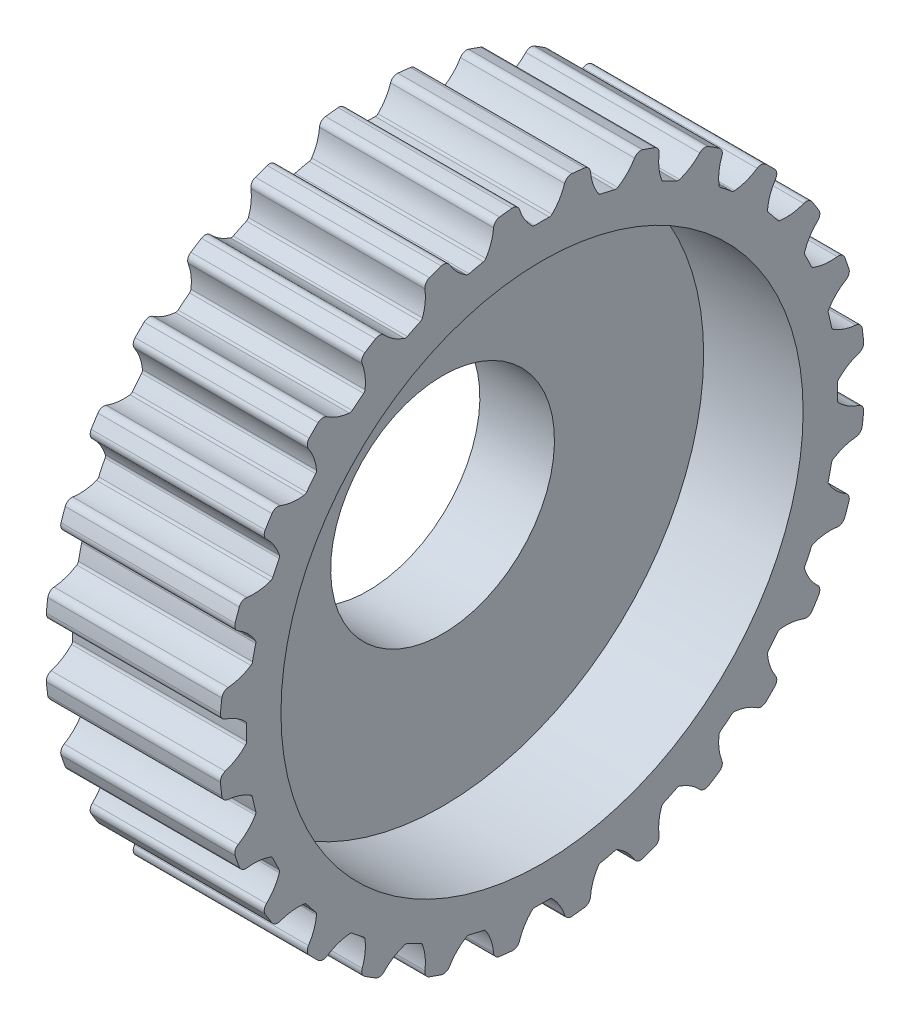
from build123d import *

# Parameters (mm, degrees)
HOLE_WIZARD_1_D          = 9
SKETCH_4_R               = 17.99
CUT_EXTRUDE_1_DEPTH      = 7
CUT_EXTRUDE_2_DEPTH      = 24.895606291
CUT_EXTRUDE_2_DEPTH_BACK = 24.895606291
SKETCH_5_W               = 12.588560779
SKETCH_5_H               = 39.970458518
SKETCH_5_W_2             = 25.674974244
SKETCH_5_H_2             = 50.140877678
SKETCH_6_R               = 10.5
CUT_EXTRUDE_3_DEPTH      = 4


with BuildPart() as part:
    # 草图1 → 旋转1 (revolve)
    with BuildSketch(Plane.XY, mode=Mode.PRIVATE) as revolve_1_sk:
        Polygon((0, 0), (0, 10), (1, 10), (1, 12.858347502), (0.495496297, 14.741180955), (1.461422123, 15), (2, 12.99), (9, 12.99), (9.538577877, 15), (10.504503703, 14.741180955), (10, 12.858347502), (10, 10), (11, 10), (11, 0), align=None)
    revolve(revolve_1_sk.sketch.rotate(Axis((11, 0, 0), (-1, 0, 0)), 270), axis=Axis((11, 0, 0), (-1, 0, 0)))

    # 孔1 (through all)
    with Locations(Plane(origin=(11, 0, 0), x_dir=(0, 0, -1), z_dir=(1, 0, 0))):
        with Locations((0, 0)):
            Hole(HOLE_WIZARD_1_D / 2)

    # 草图4 → 切除-拉伸1 (cut)
    with BuildSketch(Plane(origin=(2, 0, 0), x_dir=(0, 0, -1), z_dir=(1, 0, 0))):
        Circle(SKETCH_4_R)
        with BuildLine():
            ThreePointArc((-12.934335103, 1.201280746), (-12.888789145, 1.020492007), (-12.739828866, 0.908376719))
            ThreePointArc((-12.739828866, 0.908376719), (-12.297942775, 0.706183335), (-11.918804359, 0.402210404))
            ThreePointArc((-11.918804359, 0.402210404), (-11.886657302, 0.352337477), (-11.876364008, 0.293901271))
            ThreePointArc((-11.876364008, 0.293901271), (-11.88, 0), (-11.876364008, -0.293901271))
            ThreePointArc((-11.876364008, -0.293901271), (-11.886657302, -0.352337477), (-11.918804359, -0.402210404))
            ThreePointArc((-11.918804359, -0.402210404), (-12.297942775, -0.706183335), (-12.739828866, -0.908376719))
            ThreePointArc((-12.739828866, -0.908376719), (-12.888789145, -1.020492007), (-12.934335103, -1.201280746))
            ThreePointArc((-12.934335103, -1.201280746), (-12.908321607, -1.454418545), (-12.877354431, -1.706998197))
            ThreePointArc((-12.877354431, -1.706998197), (-12.792721126, -1.873119256), (-12.622547594, -1.9492768))
            ThreePointArc((-12.622547594, -1.9492768), (-12.146748249, -2.048071867), (-11.709475284, -2.260057328))
            ThreePointArc((-11.709475284, -2.260057328), (-11.667036451, -2.301526443), (-11.643997952, -2.356207058))
            ThreePointArc((-11.643997952, -2.356207058), (-11.582143597, -2.643548695), (-11.513199581, -2.929272164))
            ThreePointArc((-11.513199581, -2.929272164), (-11.510231522, -2.988533726), (-11.530474814, -3.044309627))
            ThreePointArc((-11.530474814, -3.044309627), (-11.832467099, -3.425027557), (-12.218281922, -3.720480436))
            ThreePointArc((-12.218281922, -3.720480436), (-12.338559457, -3.86293154), (-12.342734204, -4.049322457))
            ThreePointArc((-12.342734204, -4.049322457), (-12.261044461, -4.290325015), (-12.174649437, -4.529681124))
            ThreePointArc((-12.174649437, -4.529681124), (-12.055172652, -4.672804499), (-11.872319078, -4.70918544))
            ThreePointArc((-11.872319078, -4.70918544), (-11.386465046, -4.699628195), (-10.912984224, -4.808996348))
            ThreePointArc((-10.912984224, -4.808996348), (-10.862381675, -4.839982218), (-10.827753217, -4.888165327))
            ThreePointArc((-10.827753217, -4.888165327), (-10.703510151, -5.154538821), (-10.572715252, -5.417757118))
            ThreePointArc((-10.572715252, -5.417757118), (-10.556634671, -5.474872414), (-10.563959116, -5.533754454))
            ThreePointArc((-10.563959116, -5.533754454), (-10.773662114, -5.972126595), (-11.084059304, -6.346023728))
            ThreePointArc((-11.084059304, -6.346023728), (-11.169622877, -6.511667555), (-11.132217073, -6.694314232))
            ThreePointArc((-11.132217073, -6.694314232), (-10.998947348, -6.911096674), (-10.861456683, -7.125226924))
            ThreePointArc((-10.861456683, -7.125226924), (-10.713127484, -7.238175812), (-10.526762909, -7.232955859))
            ThreePointArc((-10.526762909, -7.232955859), (-10.055216939, -7.11552554), (-9.569270566, -7.116792211))
            ThreePointArc((-9.569270566, -7.116792211), (-9.513041724, -7.135741074), (-9.468559724, -7.175010575))
            ThreePointArc((-9.468559724, -7.175010575), (-9.288158012, -7.407058846), (-9.102070833, -7.634573108))
            ThreePointArc((-9.102070833, -7.634573108), (-9.073684076, -7.686678138), (-9.067722396, -7.745713725))
            ThreePointArc((-9.067722396, -7.745713725), (-9.174620723, -8.219758268), (-9.394035669, -8.653350892))
            ThreePointArc((-9.394035669, -8.653350892), (-9.440594765, -8.833881369), (-9.363484094, -9.003625138))
            ThreePointArc((-9.363484094, -9.003625138), (-9.185317088, -9.185317088), (-9.003625138, -9.363484094))
            ThreePointArc((-9.003625138, -9.363484094), (-8.833881369, -9.440594765), (-8.653350892, -9.394035669))
            ThreePointArc((-8.653350892, -9.394035669), (-8.219758268, -9.174620723), (-7.745713725, -9.067722396))
            ThreePointArc((-7.745713725, -9.067722396), (-7.686678138, -9.073684076), (-7.634573108, -9.102070833))
            ThreePointArc((-7.634573108, -9.102070833), (-7.407058846, -9.288158012), (-7.175010575, -9.468559724))
            ThreePointArc((-7.175010575, -9.468559724), (-7.135741074, -9.513041724), (-7.116792211, -9.569270566))
            ThreePointArc((-7.116792211, -9.569270566), (-7.11552554, -10.055216939), (-7.232955859, -10.526762909))
            ThreePointArc((-7.232955859, -10.526762909), (-7.238175812, -10.713127484), (-7.125226924, -10.861456683))
            ThreePointArc((-7.125226924, -10.861456683), (-6.911096674, -10.998947348), (-6.694314232, -11.132217073))
            ThreePointArc((-6.694314232, -11.132217073), (-6.511667555, -11.169622877), (-6.346023728, -11.084059304))
            ThreePointArc((-6.346023728, -11.084059304), (-5.972126595, -10.773662114), (-5.533754454, -10.563959116))
            ThreePointArc((-5.533754454, -10.563959116), (-5.474872414, -10.556634671), (-5.417757118, -10.572715252))
            ThreePointArc((-5.417757118, -10.572715252), (-5.154538821, -10.703510151), (-4.888165327, -10.827753217))
            ThreePointArc((-4.888165327, -10.827753217), (-4.839982218, -10.862381675), (-4.808996348, -10.912984224))
            ThreePointArc((-4.808996348, -10.912984224), (-4.699628195, -11.386465046), (-4.70918544, -11.872319078))
            ThreePointArc((-4.70918544, -11.872319078), (-4.672804499, -12.055172652), (-4.529681124, -12.174649437))
            ThreePointArc((-4.529681124, -12.174649437), (-4.290325015, -12.261044461), (-4.049322457, -12.342734204))
            ThreePointArc((-4.049322457, -12.342734204), (-3.86293154, -12.338559457), (-3.720480436, -12.218281922))
            ThreePointArc((-3.720480436, -12.218281922), (-3.425027557, -11.832467099), (-3.044309627, -11.530474814))
            ThreePointArc((-3.044309627, -11.530474814), (-2.988533726, -11.510231522), (-2.929272164, -11.513199581))
            ThreePointArc((-2.929272164, -11.513199581), (-2.643548695, -11.582143597), (-2.356207058, -11.643997952))
            ThreePointArc((-2.356207058, -11.643997952), (-2.301526443, -11.667036451), (-2.260057328, -11.709475284))
            ThreePointArc((-2.260057328, -11.709475284), (-2.048071867, -12.146748249), (-1.9492768, -12.622547594))
            ThreePointArc((-1.9492768, -12.622547594), (-1.873119256, -12.792721126), (-1.706998197, -12.877354431))
            ThreePointArc((-1.706998197, -12.877354431), (-1.454418545, -12.908321607), (-1.201280746, -12.934335103))
            ThreePointArc((-1.201280746, -12.934335103), (-1.020492007, -12.888789145), (-0.908376719, -12.739828866))
            ThreePointArc((-0.908376719, -12.739828866), (-0.706183335, -12.297942775), (-0.402210404, -11.918804359))
            ThreePointArc((-0.402210404, -11.918804359), (-0.352337477, -11.886657302), (-0.293901271, -11.876364008))
            ThreePointArc((-0.293901271, -11.876364008), (0, -11.88), (0.293901271, -11.876364008))
            ThreePointArc((0.293901271, -11.876364008), (0.352337477, -11.886657302), (0.402210404, -11.918804359))
            ThreePointArc((0.402210404, -11.918804359), (0.706183335, -12.297942775), (0.908376719, -12.739828866))
            ThreePointArc((0.908376719, -12.739828866), (1.020492007, -12.888789145), (1.201280746, -12.934335103))
            ThreePointArc((1.201280746, -12.934335103), (1.454418545, -12.908321607), (1.706998197, -12.877354431))
            ThreePointArc((1.706998197, -12.877354431), (1.873119256, -12.792721126), (1.9492768, -12.622547594))
            ThreePointArc((1.9492768, -12.622547594), (2.048071867, -12.146748249), (2.260057328, -11.709475284))
            ThreePointArc((2.260057328, -11.709475284), (2.301526443, -11.667036451), (2.356207058, -11.643997952))
            ThreePointArc((2.356207058, -11.643997952), (2.643548695, -11.582143597), (2.929272164, -11.513199581))
            ThreePointArc((2.929272164, -11.513199581), (2.988533726, -11.510231522), (3.044309627, -11.530474814))
            ThreePointArc((3.044309627, -11.530474814), (3.425027557, -11.832467099), (3.720480436, -12.218281922))
            ThreePointArc((3.720480436, -12.218281922), (3.86293154, -12.338559457), (4.049322457, -12.342734204))
            ThreePointArc((4.049322457, -12.342734204), (4.290325015, -12.261044461), (4.529681124, -12.174649437))
            ThreePointArc((4.529681124, -12.174649437), (4.672804499, -12.055172652), (4.70918544, -11.872319078))
            ThreePointArc((4.70918544, -11.872319078), (4.699628195, -11.386465046), (4.808996348, -10.912984224))
            ThreePointArc((4.808996348, -10.912984224), (4.839982218, -10.862381675), (4.888165327, -10.827753217))
            ThreePointArc((4.888165327, -10.827753217), (5.154538821, -10.703510151), (5.417757118, -10.572715252))
            ThreePointArc((5.417757118, -10.572715252), (5.474872414, -10.556634671), (5.533754454, -10.563959116))
            ThreePointArc((5.533754454, -10.563959116), (5.972126595, -10.773662114), (6.346023728, -11.084059304))
            ThreePointArc((6.346023728, -11.084059304), (6.511667555, -11.169622877), (6.694314232, -11.132217073))
            ThreePointArc((6.694314232, -11.132217073), (6.911096674, -10.998947348), (7.125226924, -10.861456683))
            ThreePointArc((7.125226924, -10.861456683), (7.238175812, -10.713127484), (7.232955859, -10.526762909))
            ThreePointArc((7.232955859, -10.526762909), (7.11552554, -10.055216939), (7.116792211, -9.569270566))
            ThreePointArc((7.116792211, -9.569270566), (7.135741074, -9.513041724), (7.175010575, -9.468559724))
            ThreePointArc((7.175010575, -9.468559724), (7.407058846, -9.288158012), (7.634573108, -9.102070833))
            ThreePointArc((7.634573108, -9.102070833), (7.686678138, -9.073684076), (7.745713725, -9.067722396))
            ThreePointArc((7.745713725, -9.067722396), (8.219758268, -9.174620723), (8.653350892, -9.394035669))
            ThreePointArc((8.653350892, -9.394035669), (8.833881369, -9.440594765), (9.003625138, -9.363484094))
            ThreePointArc((9.003625138, -9.363484094), (9.185317088, -9.185317088), (9.363484094, -9.003625138))
            ThreePointArc((9.363484094, -9.003625138), (9.440594765, -8.833881369), (9.394035669, -8.653350892))
            ThreePointArc((9.394035669, -8.653350892), (9.174620723, -8.219758268), (9.067722396, -7.745713725))
            ThreePointArc((9.067722396, -7.745713725), (9.073684076, -7.686678138), (9.102070833, -7.634573108))
            ThreePointArc((9.102070833, -7.634573108), (9.288158012, -7.407058846), (9.468559724, -7.175010575))
            ThreePointArc((9.468559724, -7.175010575), (9.513041724, -7.135741074), (9.569270566, -7.116792211))
            ThreePointArc((9.569270566, -7.116792211), (10.055216939, -7.11552554), (10.526762909, -7.232955859))
            ThreePointArc((10.526762909, -7.232955859), (10.713127484, -7.238175812), (10.861456683, -7.125226924))
            ThreePointArc((10.861456683, -7.125226924), (10.998947348, -6.911096674), (11.132217073, -6.694314232))
            ThreePointArc((11.132217073, -6.694314232), (11.169622877, -6.511667555), (11.084059304, -6.346023728))
            ThreePointArc((11.084059304, -6.346023728), (10.773662114, -5.972126595), (10.563959116, -5.533754454))
            ThreePointArc((10.563959116, -5.533754454), (10.556634671, -5.474872414), (10.572715252, -5.417757118))
            ThreePointArc((10.572715252, -5.417757118), (10.703510151, -5.154538821), (10.827753217, -4.888165327))
            ThreePointArc((10.827753217, -4.888165327), (10.862381675, -4.839982218), (10.912984224, -4.808996348))
            ThreePointArc((10.912984224, -4.808996348), (11.386465046, -4.699628195), (11.872319078, -4.70918544))
            ThreePointArc((11.872319078, -4.70918544), (12.055172652, -4.672804499), (12.174649437, -4.529681124))
            ThreePointArc((12.174649437, -4.529681124), (12.261044461, -4.290325015), (12.342734204, -4.049322457))
            ThreePointArc((12.342734204, -4.049322457), (12.338559457, -3.86293154), (12.218281922, -3.720480436))
            ThreePointArc((12.218281922, -3.720480436), (11.832467099, -3.425027557), (11.530474814, -3.044309627))
            ThreePointArc((11.530474814, -3.044309627), (11.510231522, -2.988533726), (11.513199581, -2.929272164))
            ThreePointArc((11.513199581, -2.929272164), (11.582143597, -2.643548695), (11.643997952, -2.356207058))
            ThreePointArc((11.643997952, -2.356207058), (11.667036451, -2.301526443), (11.709475284, -2.260057328))
            ThreePointArc((11.709475284, -2.260057328), (12.146748249, -2.048071867), (12.622547594, -1.9492768))
            ThreePointArc((12.622547594, -1.9492768), (12.792721126, -1.873119256), (12.877354431, -1.706998197))
            ThreePointArc((12.877354431, -1.706998197), (12.908321607, -1.454418545), (12.934335103, -1.201280746))
            ThreePointArc((12.934335103, -1.201280746), (12.888789145, -1.020492007), (12.739828866, -0.908376719))
            ThreePointArc((12.739828866, -0.908376719), (12.297942775, -0.706183335), (11.918804359, -0.402210404))
            ThreePointArc((11.918804359, -0.402210404), (11.886657302, -0.352337477), (11.876364008, -0.293901271))
            ThreePointArc((11.876364008, -0.293901271), (11.88, 0), (11.876364008, 0.293901271))
            ThreePointArc((11.876364008, 0.293901271), (11.886657302, 0.352337477), (11.918804359, 0.402210404))
            ThreePointArc((11.918804359, 0.402210404), (12.297942775, 0.706183335), (12.739828866, 0.908376719))
            ThreePointArc((12.739828866, 0.908376719), (12.888789145, 1.020492007), (12.934335103, 1.201280746))
            ThreePointArc((12.934335103, 1.201280746), (12.908321607, 1.454418545), (12.877354431, 1.706998197))
            ThreePointArc((12.877354431, 1.706998197), (12.792721126, 1.873119256), (12.622547594, 1.9492768))
            ThreePointArc((12.622547594, 1.9492768), (12.146748249, 2.048071867), (11.709475284, 2.260057328))
            ThreePointArc((11.709475284, 2.260057328), (11.667036451, 2.301526443), (11.643997952, 2.356207058))
            ThreePointArc((11.643997952, 2.356207058), (11.582143597, 2.643548695), (11.513199581, 2.929272164))
            ThreePointArc((11.513199581, 2.929272164), (11.510231522, 2.988533726), (11.530474814, 3.044309627))
            ThreePointArc((11.530474814, 3.044309627), (11.832467099, 3.425027557), (12.218281922, 3.720480436))
            ThreePointArc((12.218281922, 3.720480436), (12.338559457, 3.86293154), (12.342734204, 4.049322457))
            ThreePointArc((12.342734204, 4.049322457), (12.261044461, 4.290325015), (12.174649437, 4.529681124))
            ThreePointArc((12.174649437, 4.529681124), (12.055172652, 4.672804499), (11.872319078, 4.70918544))
            ThreePointArc((11.872319078, 4.70918544), (11.386465046, 4.699628195), (10.912984224, 4.808996348))
            ThreePointArc((10.912984224, 4.808996348), (10.862381675, 4.839982218), (10.827753217, 4.888165327))
            ThreePointArc((10.827753217, 4.888165327), (10.703510151, 5.154538821), (10.572715252, 5.417757118))
            ThreePointArc((10.572715252, 5.417757118), (10.556634671, 5.474872414), (10.563959116, 5.533754454))
            ThreePointArc((10.563959116, 5.533754454), (10.773662114, 5.972126595), (11.084059304, 6.346023728))
            ThreePointArc((11.084059304, 6.346023728), (11.169622877, 6.511667555), (11.132217073, 6.694314232))
            ThreePointArc((11.132217073, 6.694314232), (10.998947348, 6.911096674), (10.861456683, 7.125226924))
            ThreePointArc((10.861456683, 7.125226924), (10.713127484, 7.238175812), (10.526762909, 7.232955859))
            ThreePointArc((10.526762909, 7.232955859), (10.055216939, 7.11552554), (9.569270566, 7.116792211))
            ThreePointArc((9.569270566, 7.116792211), (9.513041724, 7.135741074), (9.468559724, 7.175010575))
            ThreePointArc((9.468559724, 7.175010575), (9.288158012, 7.407058846), (9.102070833, 7.634573108))
            ThreePointArc((9.102070833, 7.634573108), (9.073684076, 7.686678138), (9.067722396, 7.745713725))
            ThreePointArc((9.067722396, 7.745713725), (9.174620723, 8.219758268), (9.394035669, 8.653350892))
            ThreePointArc((9.394035669, 8.653350892), (9.440594765, 8.833881369), (9.363484094, 9.003625138))
            ThreePointArc((9.363484094, 9.003625138), (9.185317088, 9.185317088), (9.003625138, 9.363484094))
            ThreePointArc((9.003625138, 9.363484094), (8.833881369, 9.440594765), (8.653350892, 9.394035669))
            ThreePointArc((8.653350892, 9.394035669), (8.219758268, 9.174620723), (7.745713725, 9.067722396))
            ThreePointArc((7.745713725, 9.067722396), (7.686678138, 9.073684076), (7.634573108, 9.102070833))
            ThreePointArc((7.634573108, 9.102070833), (7.407058846, 9.288158012), (7.175010575, 9.468559724))
            ThreePointArc((7.175010575, 9.468559724), (7.135741074, 9.513041724), (7.116792211, 9.569270566))
            ThreePointArc((7.116792211, 9.569270566), (7.11552554, 10.055216939), (7.232955859, 10.526762909))
            ThreePointArc((7.232955859, 10.526762909), (7.238175812, 10.713127484), (7.125226924, 10.861456683))
            ThreePointArc((7.125226924, 10.861456683), (6.911096674, 10.998947348), (6.694314232, 11.132217073))
            ThreePointArc((6.694314232, 11.132217073), (6.511667555, 11.169622877), (6.346023728, 11.084059304))
            ThreePointArc((6.346023728, 11.084059304), (5.972126595, 10.773662114), (5.533754454, 10.563959116))
            ThreePointArc((5.533754454, 10.563959116), (5.474872414, 10.556634671), (5.417757118, 10.572715252))
            ThreePointArc((5.417757118, 10.572715252), (5.154538821, 10.703510151), (4.888165327, 10.827753217))
            ThreePointArc((4.888165327, 10.827753217), (4.839982218, 10.862381675), (4.808996348, 10.912984224))
            ThreePointArc((4.808996348, 10.912984224), (4.699628195, 11.386465046), (4.70918544, 11.872319078))
            ThreePointArc((4.70918544, 11.872319078), (4.672804499, 12.055172652), (4.529681124, 12.174649437))
            ThreePointArc((4.529681124, 12.174649437), (4.290325015, 12.261044461), (4.049322457, 12.342734204))
            ThreePointArc((4.049322457, 12.342734204), (3.86293154, 12.338559457), (3.720480436, 12.218281922))
            ThreePointArc((3.720480436, 12.218281922), (3.425027557, 11.832467099), (3.044309627, 11.530474814))
            ThreePointArc((3.044309627, 11.530474814), (2.988533726, 11.510231522), (2.929272164, 11.513199581))
            ThreePointArc((2.929272164, 11.513199581), (2.643548695, 11.582143597), (2.356207058, 11.643997952))
            ThreePointArc((2.356207058, 11.643997952), (2.301526443, 11.667036451), (2.260057328, 11.709475284))
            ThreePointArc((2.260057328, 11.709475284), (2.048071867, 12.146748249), (1.9492768, 12.622547594))
            ThreePointArc((1.9492768, 12.622547594), (1.873119256, 12.792721126), (1.706998197, 12.877354431))
            ThreePointArc((1.706998197, 12.877354431), (1.454418545, 12.908321607), (1.201280746, 12.934335103))
            ThreePointArc((1.201280746, 12.934335103), (1.020492007, 12.888789145), (0.908376719, 12.739828866))
            ThreePointArc((0.908376719, 12.739828866), (0.706183335, 12.297942775), (0.402210404, 11.918804359))
            ThreePointArc((0.402210404, 11.918804359), (0.352337477, 11.886657302), (0.293901271, 11.876364008))
            ThreePointArc((0.293901271, 11.876364008), (0, 11.88), (-0.293901271, 11.876364008))
            ThreePointArc((-0.293901271, 11.876364008), (-0.352337477, 11.886657302), (-0.402210404, 11.918804359))
            ThreePointArc((-0.402210404, 11.918804359), (-0.706183335, 12.297942775), (-0.908376719, 12.739828866))
            ThreePointArc((-0.908376719, 12.739828866), (-1.020492007, 12.888789145), (-1.201280746, 12.934335103))
            ThreePointArc((-1.201280746, 12.934335103), (-1.454418545, 12.908321607), (-1.706998197, 12.877354431))
            ThreePointArc((-1.706998197, 12.877354431), (-1.873119256, 12.792721126), (-1.9492768, 12.622547594))
            ThreePointArc((-1.9492768, 12.622547594), (-2.048071867, 12.146748249), (-2.260057328, 11.709475284))
            ThreePointArc((-2.260057328, 11.709475284), (-2.301526443, 11.667036451), (-2.356207058, 11.643997952))
            ThreePointArc((-2.356207058, 11.643997952), (-2.643548695, 11.582143597), (-2.929272164, 11.513199581))
            ThreePointArc((-2.929272164, 11.513199581), (-2.988533726, 11.510231522), (-3.044309627, 11.530474814))
            ThreePointArc((-3.044309627, 11.530474814), (-3.425027557, 11.832467099), (-3.720480436, 12.218281922))
            ThreePointArc((-3.720480436, 12.218281922), (-3.86293154, 12.338559457), (-4.049322457, 12.342734204))
            ThreePointArc((-4.049322457, 12.342734204), (-4.290325015, 12.261044461), (-4.529681124, 12.174649437))
            ThreePointArc((-4.529681124, 12.174649437), (-4.672804499, 12.055172652), (-4.70918544, 11.872319078))
            ThreePointArc((-4.70918544, 11.872319078), (-4.699628195, 11.386465046), (-4.808996348, 10.912984224))
            ThreePointArc((-4.808996348, 10.912984224), (-4.839982218, 10.862381675), (-4.888165327, 10.827753217))
            ThreePointArc((-4.888165327, 10.827753217), (-5.154538821, 10.703510151), (-5.417757118, 10.572715252))
            ThreePointArc((-5.417757118, 10.572715252), (-5.474872414, 10.556634671), (-5.533754454, 10.563959116))
            ThreePointArc((-5.533754454, 10.563959116), (-5.972126595, 10.773662114), (-6.346023728, 11.084059304))
            ThreePointArc((-6.346023728, 11.084059304), (-6.511667555, 11.169622877), (-6.694314232, 11.132217073))
            ThreePointArc((-6.694314232, 11.132217073), (-6.911096674, 10.998947348), (-7.125226924, 10.861456683))
            ThreePointArc((-7.125226924, 10.861456683), (-7.238175812, 10.713127484), (-7.232955859, 10.526762909))
            ThreePointArc((-7.232955859, 10.526762909), (-7.11552554, 10.055216939), (-7.116792211, 9.569270566))
            ThreePointArc((-7.116792211, 9.569270566), (-7.135741074, 9.513041724), (-7.175010575, 9.468559724))
            ThreePointArc((-7.175010575, 9.468559724), (-7.407058846, 9.288158012), (-7.634573108, 9.102070833))
            ThreePointArc((-7.634573108, 9.102070833), (-7.686678138, 9.073684076), (-7.745713725, 9.067722396))
            ThreePointArc((-7.745713725, 9.067722396), (-8.219758268, 9.174620723), (-8.653350892, 9.394035669))
            ThreePointArc((-8.653350892, 9.394035669), (-8.833881369, 9.440594765), (-9.003625138, 9.363484094))
            ThreePointArc((-9.003625138, 9.363484094), (-9.185317088, 9.185317088), (-9.363484094, 9.003625138))
            ThreePointArc((-9.363484094, 9.003625138), (-9.440594765, 8.833881369), (-9.394035669, 8.653350892))
            ThreePointArc((-9.394035669, 8.653350892), (-9.174620723, 8.219758268), (-9.067722396, 7.745713725))
            ThreePointArc((-9.067722396, 7.745713725), (-9.073684076, 7.686678138), (-9.102070833, 7.634573108))
            ThreePointArc((-9.102070833, 7.634573108), (-9.288158012, 7.407058846), (-9.468559724, 7.175010575))
            ThreePointArc((-9.468559724, 7.175010575), (-9.513041724, 7.135741074), (-9.569270566, 7.116792211))
            ThreePointArc((-9.569270566, 7.116792211), (-10.055216939, 7.11552554), (-10.526762909, 7.232955859))
            ThreePointArc((-10.526762909, 7.232955859), (-10.713127484, 7.238175812), (-10.861456683, 7.125226924))
            ThreePointArc((-10.861456683, 7.125226924), (-10.998947348, 6.911096674), (-11.132217073, 6.694314232))
            ThreePointArc((-11.132217073, 6.694314232), (-11.169622877, 6.511667555), (-11.084059304, 6.346023728))
            ThreePointArc((-11.084059304, 6.346023728), (-10.773662114, 5.972126595), (-10.563959116, 5.533754454))
            ThreePointArc((-10.563959116, 5.533754454), (-10.556634671, 5.474872414), (-10.572715252, 5.417757118))
            ThreePointArc((-10.572715252, 5.417757118), (-10.703510151, 5.154538821), (-10.827753217, 4.888165327))
            ThreePointArc((-10.827753217, 4.888165327), (-10.862381675, 4.839982218), (-10.912984224, 4.808996348))
            ThreePointArc((-10.912984224, 4.808996348), (-11.386465046, 4.699628195), (-11.872319078, 4.70918544))
            ThreePointArc((-11.872319078, 4.70918544), (-12.055172652, 4.672804499), (-12.174649437, 4.529681124))
            ThreePointArc((-12.174649437, 4.529681124), (-12.261044461, 4.290325015), (-12.342734204, 4.049322457))
            ThreePointArc((-12.342734204, 4.049322457), (-12.338559457, 3.86293154), (-12.218281922, 3.720480436))
            ThreePointArc((-12.218281922, 3.720480436), (-11.832467099, 3.425027557), (-11.530474814, 3.044309627))
            ThreePointArc((-11.530474814, 3.044309627), (-11.510231522, 2.988533726), (-11.513199581, 2.929272164))
            ThreePointArc((-11.513199581, 2.929272164), (-11.582143597, 2.643548695), (-11.643997952, 2.356207058))
            ThreePointArc((-11.643997952, 2.356207058), (-11.667036451, 2.301526443), (-11.709475284, 2.260057328))
            ThreePointArc((-11.709475284, 2.260057328), (-12.146748249, 2.048071867), (-12.622547594, 1.9492768))
            ThreePointArc((-12.622547594, 1.9492768), (-12.792721126, 1.873119256), (-12.877354431, 1.706998197))
            ThreePointArc((-12.877354431, 1.706998197), (-12.908321607, 1.454418545), (-12.934335103, 1.201280746))
        make_face(mode=Mode.SUBTRACT)
    extrude(amount=CUT_EXTRUDE_1_DEPTH, mode=Mode.SUBTRACT)

    # 草图5 → 切除-拉伸2 (cut, two sides: drawn at the far end of the back side and taken through both)
    with BuildSketch(Plane.XY.offset(-CUT_EXTRUDE_2_DEPTH_BACK)):
        with Locations((-4.294280389, -1.244631715)):
            Rectangle(SKETCH_5_W, SKETCH_5_H)
        with Locations((21.837487122, 2.560385243)):
            Rectangle(SKETCH_5_W_2, SKETCH_5_H_2)
    extrude(amount=CUT_EXTRUDE_2_DEPTH + CUT_EXTRUDE_2_DEPTH_BACK, mode=Mode.SUBTRACT)

    # 草图6 → 切除-拉伸3 (cut)
    with BuildSketch(Plane(origin=(9, 0, 0), x_dir=(0, 0, -1), z_dir=(1, 0, 0))):
        Circle(SKETCH_6_R)
    extrude(amount=-CUT_EXTRUDE_3_DEPTH, mode=Mode.SUBTRACT)


solid = part.part
